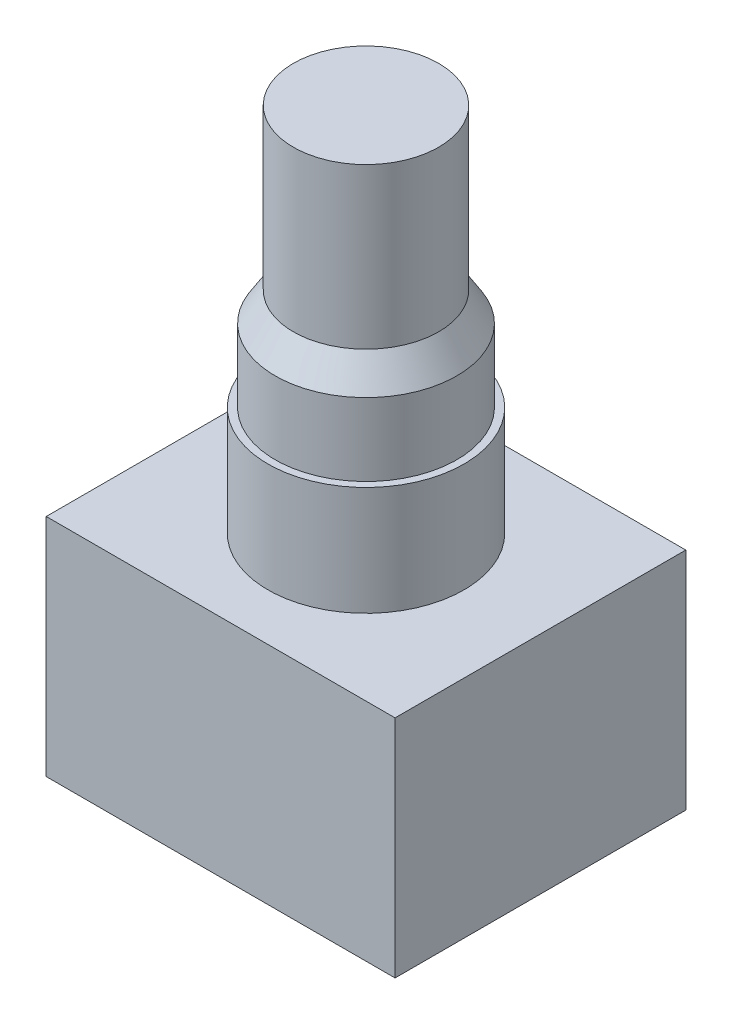
from build123d import *

# Parameters (mm, degrees)
SKETCH1_W           = 12.192
SKETCH1_H           = 10.16
BOSS_EXTRUDE1_DEPTH = 7.874


with BuildPart() as part:
    # Sketch1 → Boss-Extrude1 (new body)
    with BuildSketch(Plane(origin=(0, 0, 0), x_dir=(1, 0, 0), z_dir=(0, 1, 0))):
        Rectangle(SKETCH1_W, SKETCH1_H)
    extrude(amount=-BOSS_EXTRUDE1_DEPTH)

    # Sketch2 → Revolve1 (revolve)
    with BuildSketch(Plane(origin=(0, 0, 0), x_dir=(0, 0, -1), z_dir=(1, 0, 0))):
        Polygon((0, 0), (3.429, 0), (3.429, 3.81), (3.175, 3.81), (3.175, 6.35), (2.54, 7.366), (2.54, 12.954), (0, 12.954), align=None)
    revolve(axis=Axis((0, 0, 0), (0, 1, 0)))


solid = part.part
